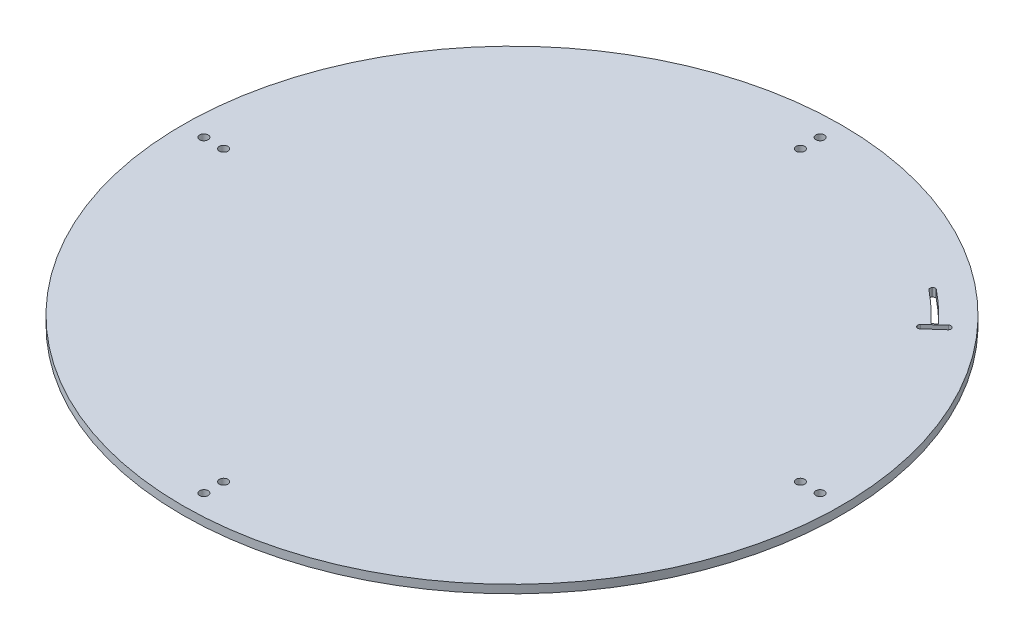
from build123d import *

# Parameters (mm, degrees)
SKETCH_1_R               = 200
EXTRUDE_257_DEPTH        = 5
CUT_EXTRUDE_3_REACH      = 284.887
SKETCH_2_R               = 2.6
PATTERN_CIRCULAR_1_COUNT = 4
SKETCH_4_W               = 3.2
SKETCH_4_H               = 12.2
CUT_REVOLVE_3_ANGLE      = 8.5
FILLET_2_R               = 1.5
CUT_EXTRUDE_1561_REACH   = 284.887
FILLET_1_R               = 1.5


with BuildPart() as part:
    # 草图1 → Extrude 257 (new body)
    with BuildSketch(Plane(origin=(0, 0, 0), x_dir=(1, 0, 0), z_dir=(0, 1, 0))):
        Circle(SKETCH_1_R)
    extrude(amount=EXTRUDE_257_DEPTH)

    # 草图2 → 切除-拉伸3 (cut, up to next)
    with BuildSketch(Plane(origin=(0, 5, 0), x_dir=(1, 0, 0), z_dir=(0, 1, 0)), mode=Mode.PRIVATE) as cut_extrude_3_sk1:
        with Locations((0, -175)):
            Circle(SKETCH_2_R)
    cut_extrude_3_tool1 = extrude(cut_extrude_3_sk1.sketch, amount=-CUT_EXTRUDE_3_REACH, mode=Mode.PRIVATE) & part.part
    # 草图2 → 切除-拉伸3 (cut, up to next)
    with BuildSketch(Plane(origin=(0, 5, 0), x_dir=(1, 0, 0), z_dir=(0, 1, 0)), mode=Mode.PRIVATE) as cut_extrude_3_sk2:
        with Locations((0, -187)):
            Circle(SKETCH_2_R)
    cut_extrude_3_tool2 = extrude(cut_extrude_3_sk2.sketch, amount=-CUT_EXTRUDE_3_REACH, mode=Mode.PRIVATE) & part.part
    cut_extrude_3_1 = cut_extrude_3_tool1.solids().sort_by_distance((0, 5, 175))[0]
    add(cut_extrude_3_1, mode=Mode.SUBTRACT)
    cut_extrude_3_2 = cut_extrude_3_tool2.solids().sort_by_distance((0, 5, 187))[0]
    add(cut_extrude_3_2, mode=Mode.SUBTRACT)
    cut_extrude_3 = cut_extrude_3_1 + cut_extrude_3_2  # 切除-拉伸3 as one shape, for the pattern or mirror that repeats it

    # 阵列(圆周)1: 切除-拉伸3 ×4 about axis
    pattern_circular_1_axis = Axis((0, -55, 0), (0, 1, 0))
    for i in range(1, PATTERN_CIRCULAR_1_COUNT):
        add(cut_extrude_3.rotate(pattern_circular_1_axis, i * 360 / PATTERN_CIRCULAR_1_COUNT), mode=Mode.SUBTRACT)

    # 草图4 → 切除-旋转3 (revolve, cut)
    with BuildSketch(Plane(origin=(0, 0, 0), x_dir=(0.73135370161917, 0, -0.6819983600624991), z_dir=(0.6819983600624991, 0, 0.73135370161917))):
        with Locations((181.5, 3)):
            Rectangle(SKETCH_4_W, SKETCH_4_H)
    revolve(axis=Axis((0, -55, 0), (0, 1, 0)), revolution_arc=CUT_REVOLVE_3_ANGLE, mode=Mode.SUBTRACT)

    # 圆角2
    fillet_2_edges = [part.edges().sort_by_distance(p)[0] for p in [
        (111.990383131, 2.5, -140.791207418),
        (113.982429968, 2.5, -143.29555352),
    ]]
    fillet(fillet_2_edges, radius=FILLET_2_R)

    # 草图6 → Cut-Extrude 1561 (cut, up to next)
    with BuildSketch(Plane(origin=(0, 5, 0), x_dir=(1, 0, 0), z_dir=(0, 1, 0)), mode=Mode.PRIVATE) as cut_extrude_1561_sk1:
        with BuildLine():
            Line((127.646791587, 118.032637546), (138.809893683, 128.343047734))
            ThreePointArc((138.809893683, 128.343047734), (139.99182369, 127.052799206), (141.161761211, 125.751666622))
            Line((141.161761211, 125.751666622), (129.820417839, 115.637649754))
            ThreePointArc((129.820417839, 115.637649754), (128.739174201, 116.840198367), (127.646791587, 118.032637546))
        make_face()
    cut_extrude_1561_tool1 = extrude(cut_extrude_1561_sk1.sketch, amount=-CUT_EXTRUDE_1561_REACH, mode=Mode.PRIVATE) & part.part
    add(cut_extrude_1561_tool1.solids().sort_by_distance((134.437436, 5, -122.011787))[0], mode=Mode.SUBTRACT)

    # 圆角1
    fillet_1_edges = [part.edges().sort_by_distance(p)[0] for p in [
        (129.820417839, 2.5, -115.637649754),
        (141.161761211, 2.5, -125.751666622),
        (138.809893683, 2.5, -128.343047734),
        (127.646791587, 2.5, -118.032637546),
    ]]
    fillet(fillet_1_edges, radius=FILLET_1_R)


solid = part.part
